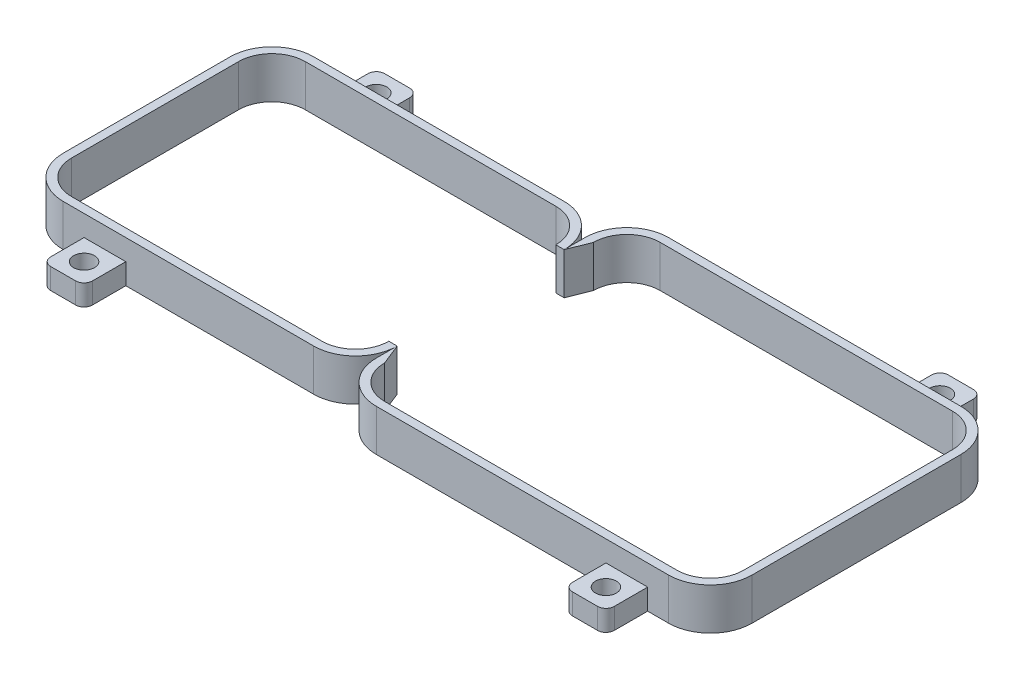
from build123d import *

# Parameters (mm, degrees)
BOSS_EXTRUDE1_DEPTH   = 10
BOSS_EXTRUDE1_2_DEPTH = 10
SKETCH3_W             = 10
SKETCH3_H             = 5
BOSS_EXTRUDE8_DEPTH   = 10
SKETCH4_R             = 2.5
CUT_EXTRUDE1_DEPTH    = 10
FILLET1_R             = 2
FILLET1_OF_MIRROR4_R  = 2
SKETCH5_W             = 10
SKETCH5_H             = 5
BOSS_EXTRUDE9_DEPTH   = 10
SKETCH7_R             = 2.5
CUT_EXTRUDE2_DEPTH    = 10
FILLET3_R             = 2
FILLET3_OF_MIRROR18_R = 2


with BuildPart() as part:
    # Sketch1 → Boss-Extrude1 (new body)
    with BuildSketch(Plane(origin=(0, 0, 0), x_dir=(1, 0, 0), z_dir=(0, 1, 0))):
        with BuildLine():
            Line((-55, 28), (-115, 28))
            ThreePointArc((-115, 28), (-120.656854249, 25.656854249), (-123, 20))
            Line((-123, 20), (-123, -20))
            ThreePointArc((-123, -20), (-120.656854249, -25.656854249), (-115, -28))
            Line((-115, -28), (-55, -28))
            ThreePointArc((-55, -28), (-49.343145751, -25.656854249), (-47, -20))
            Line((-47, -20), (-45, -20))
            ThreePointArc((-45, -20), (-47.928932188, -27.071067812), (-55, -30))
            Line((-55, -30), (-115, -30))
            ThreePointArc((-115, -30), (-122.071067812, -27.071067812), (-125, -20))
            Line((-125, -20), (-125, 20))
            ThreePointArc((-125, 20), (-122.071067812, 27.071067812), (-115, 30))
            Line((-115, 30), (-55, 30))
            ThreePointArc((-55, 30), (-47.928932188, 27.071067812), (-45, 20))
            Line((-45, 20), (-47, 20))
            ThreePointArc((-47, 20), (-49.343145751, 25.656854249), (-55, 28))
        make_face()
    extrude(amount=BOSS_EXTRUDE1_DEPTH)

    # Sketch3 → Boss-Extrude8 (add)
    with BuildSketch(Plane.XY.offset(30)):
        with Locations((-105, 2.5)):
            Rectangle(SKETCH3_W, SKETCH3_H)
    boss_extrude8 = extrude(amount=BOSS_EXTRUDE8_DEPTH)

    # Sketch4 → Cut-Extrude1 (cut)
    with BuildSketch(Plane(origin=(0, 5, 0), x_dir=(1, 0, 0), z_dir=(0, 1, 0))):
        with Locations(Location((-105, -35, 0), (0, 0, 270))):
            Circle(SKETCH4_R)
    cut_extrude1 = extrude(amount=-CUT_EXTRUDE1_DEPTH, mode=Mode.SUBTRACT)

    # Fillet1
    fillet1_edges = [part.edges().sort_by_distance(p)[0] for p in [
        (-110, 2.5, 40),
        (-100, 2.5, 40),
    ]]
    fillet(fillet1_edges, radius=FILLET1_R)

    # Mirror4: Boss-Extrude8, Cut-Extrude1 across plane
    add(boss_extrude8.mirror(Plane.XY))
    add(cut_extrude1.mirror(Plane.XY), mode=Mode.SUBTRACT)

    # Fillet1 of Mirror4
    fillet1_of_mirror4_edges = [part.edges().sort_by_distance(p)[0] for p in [
        (-110, 2.5, -40),
        (-100, 2.5, -40),
    ]]
    fillet(fillet1_of_mirror4_edges, radius=FILLET1_OF_MIRROR4_R)


with BuildPart() as body_2:
    # Sketch1 → Boss-Extrude1 2 (new body)
    with BuildSketch(Plane(origin=(0, 0, 0), x_dir=(1, 0, 0), z_dir=(0, 1, 0))):
        with BuildLine():
            ThreePointArc((35, -33), (40.656854249, -30.656854249), (43, -25))
            Line((43, -25), (43, 25))
            ThreePointArc((43, 25), (40.656854249, 30.656854249), (35, 33))
            Line((35, 33), (-35, 33))
            ThreePointArc((-35, 33), (-40.656854249, 30.656854249), (-43, 25))
            Line((-43, 25), (-45, 20))
            Line((-45, 20), (-45, 25))
            ThreePointArc((-45, 25), (-42.071067812, 32.071067812), (-35, 35))
            Line((-35, 35), (35, 35))
            ThreePointArc((35, 35), (42.071067812, 32.071067812), (45, 25))
            Line((45, 25), (45, -25))
            ThreePointArc((45, -25), (42.071067812, -32.071067812), (35, -35))
            Line((35, -35), (-35, -35))
            ThreePointArc((-35, -35), (-42.071067812, -32.071067812), (-45, -25))
            Line((-45, -25), (-45, -20))
            Line((-45, -20), (-43, -25))
            ThreePointArc((-43, -25), (-40.656854249, -30.656854249), (-35, -33))
            Line((-35, -33), (35, -33))
        make_face()
    extrude(amount=BOSS_EXTRUDE1_2_DEPTH)

    # Sketch5 → Boss-Extrude9 (add)
    with BuildSketch(Plane.XY.offset(35)):
        with Locations((25, 2.5)):
            Rectangle(SKETCH5_W, SKETCH5_H)
    boss_extrude9 = extrude(amount=BOSS_EXTRUDE9_DEPTH)

    # Sketch7 → Cut-Extrude2 (cut)
    with BuildSketch(Plane(origin=(0, 5, 0), x_dir=(1, 0, 0), z_dir=(0, 1, 0))):
        with Locations(Location((25, -40, 0), (0, 0, 270))):
            Circle(SKETCH7_R)
    cut_extrude2 = extrude(amount=-CUT_EXTRUDE2_DEPTH, mode=Mode.SUBTRACT)

    # Fillet3
    fillet3_edges = [body_2.edges().sort_by_distance(p)[0] for p in [
        (30, 2.5, 45),
        (20, 2.5, 45),
    ]]
    fillet(fillet3_edges, radius=FILLET3_R)

    # Mirror18: Boss-Extrude9, Cut-Extrude2 across plane
    add(boss_extrude9.mirror(Plane.XY))
    add(cut_extrude2.mirror(Plane.XY), mode=Mode.SUBTRACT)

    # Fillet3 of Mirror18
    fillet3_of_mirror18_edges = [body_2.edges().sort_by_distance(p)[0] for p in [
        (30, 2.5, -45),
        (20, 2.5, -45),
    ]]
    fillet(fillet3_of_mirror18_edges, radius=FILLET3_OF_MIRROR18_R)


solid = Compound([part.part, body_2.part])
